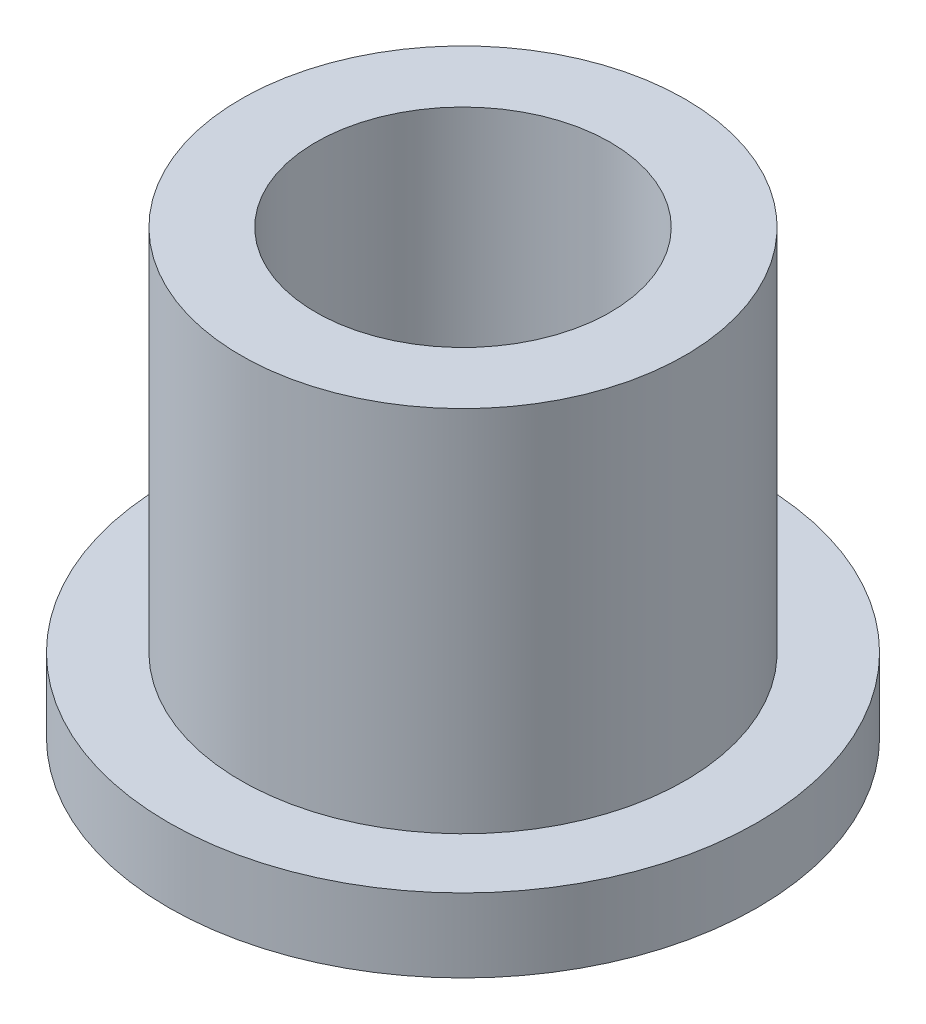
from build123d import *

# Parameters (mm, degrees)
SKETCH2_R           = 4.7879
SKETCH2_R_2         = 3.175
BOSS_EXTRUDE1_DEPTH = 9.525
SKETCH3_R           = 6.35
SKETCH3_R_2         = 4.7879
BOSS_EXTRUDE2_DEPTH = 1.5875


with BuildPart() as part:
    # Sketch2 → Boss-Extrude1 (new body)
    with BuildSketch(Plane(origin=(0, 0, 0), x_dir=(1, 0, 0), z_dir=(0, 1, 0))):
        with Locations(Location((0, 0, 0), (0, 0, 90))):
            Circle(SKETCH2_R)
        with Locations(Location((0, 0, 0), (0, 0, 90))):
            Circle(SKETCH2_R_2, mode=Mode.SUBTRACT)
    extrude(amount=BOSS_EXTRUDE1_DEPTH)

    # Sketch3 → Boss-Extrude2 (add)
    with BuildSketch(Plane(origin=(0, 0, 0), x_dir=(1, 0, 0), z_dir=(0, 1, 0))):
        with Locations(Location((0, 0, 0), (0, 0, 270))):
            Circle(SKETCH3_R)
        with Locations(Location((0, 0, 0), (0, 0, 90))):
            Circle(SKETCH3_R_2, mode=Mode.SUBTRACT)
    extrude(amount=BOSS_EXTRUDE2_DEPTH)


solid = part.part
